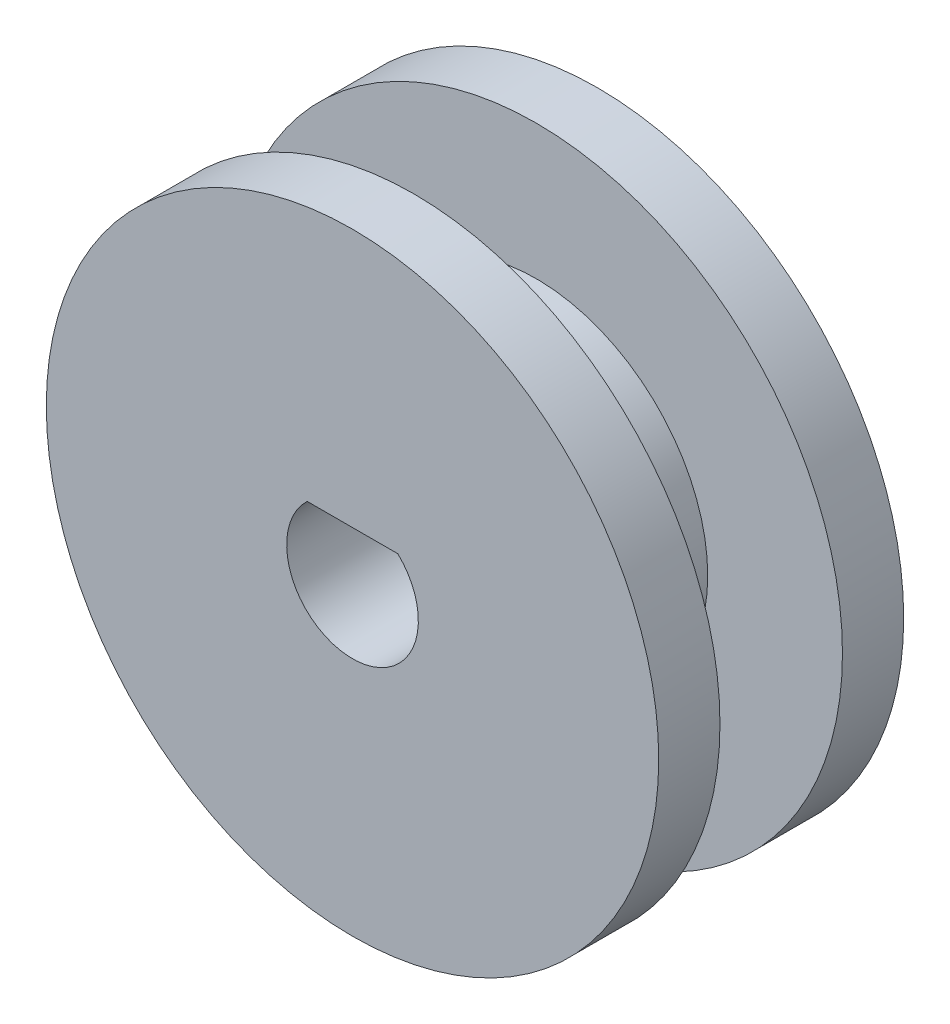
from build123d import *

# Parameters (mm, degrees)
SKETCH1_R           = 10
BOSS_EXTRUDE1_DEPTH = 2
SKETCH2_R           = 5.6
BOSS_EXTRUDE2_DEPTH = 4
SKETCH3_R           = 10
BOSS_EXTRUDE3_DEPTH = 2
CUT_EXTRUDE1_DEPTH  = 17.248076809


with BuildPart() as part:
    # Sketch1 → Boss-Extrude1 (new body)
    with BuildSketch(Plane.XY):
        Circle(SKETCH1_R)
    extrude(amount=BOSS_EXTRUDE1_DEPTH)

    # Sketch2 → Boss-Extrude2 (add)
    with BuildSketch(Plane.XY.offset(2)):
        Circle(SKETCH2_R)
    extrude(amount=BOSS_EXTRUDE2_DEPTH)

    # Sketch3 → Boss-Extrude3 (add)
    with BuildSketch(Plane.XY.offset(6)):
        Circle(SKETCH3_R)
    extrude(amount=BOSS_EXTRUDE3_DEPTH)

    # Sketch6 → Cut-Extrude1 (cut, through all)
    with BuildSketch(Plane.XY.offset(8)):
        with BuildLine():
            Line((1.479493156, 1.56), (-1.479493156, 1.56))
            ThreePointArc((-1.479493156, 1.56), (-0.848996382, -1.975273435), (2.15, 0))
            ThreePointArc((2.15, 0), (1.975273435, 0.848996382), (1.479493156, 1.56))
        make_face()
    extrude(amount=-CUT_EXTRUDE1_DEPTH, mode=Mode.SUBTRACT)


solid = part.part
